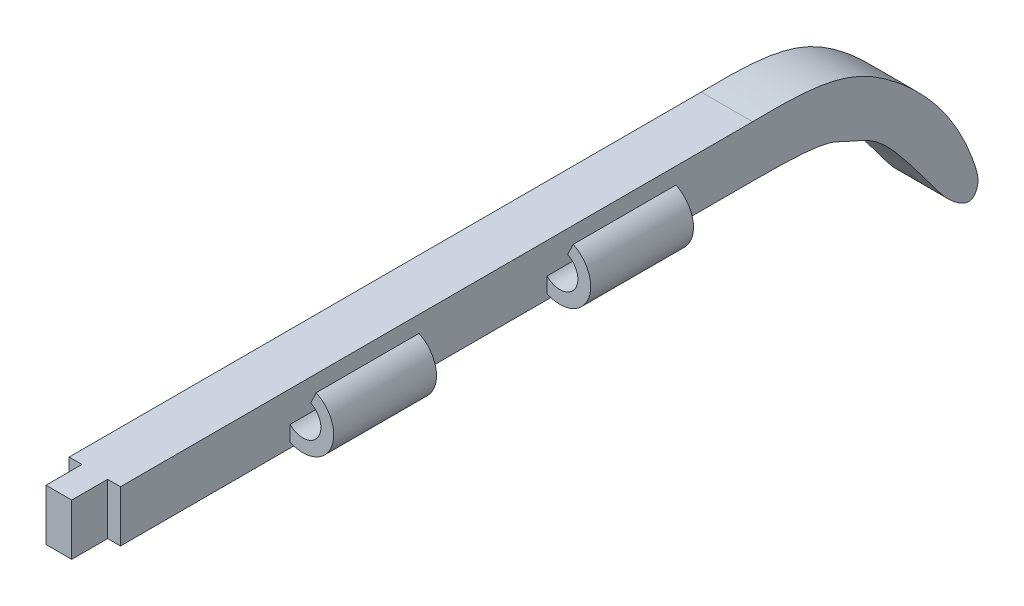
from build123d import *

# Parameters (mm, degrees)
BOSS_EXTRUDE1_DEPTH = 10
BOSS_EXTRUDE2_DEPTH = 10
SKETCH7_W           = 2.5
SKETCH7_H           = 10
CUT_EXTRUDE1_DEPTH  = 7


with BuildPart() as part:
    # Sketch3 → Boss-Extrude1 (new body)
    with BuildSketch(Plane(origin=(0, 0, 0), x_dir=(0, 0, -1), z_dir=(1, 0, 0))):
        with BuildLine():
            Line((0, 10), (130, 10))
            add(Edge.make_bspline(
                [(130, 10), (143.257831062, 10.295968591), (152.362580677, 8.411339369), (167.478605766, -5.773344354), (172.615930834, -16.282094646), (174.074786887, -21.87323482), (172.857902226, -25.275077888), (168.561594529, -23.155195651), (157.061538089, -7.448521863), (154.600537824, -5.126556057), (145.232328073, -1.239475242), (144.477420142, 0), (130, 0)],
                knots=[0, 0, 0, 0, 0.101519052, 0.157910707, 0.21054164, 0.223356202, 0.228060175, 0.254301241, 0.299209562, 0.632235058, 0.706476921, 1, 1, 1, 1], degree=3))
            Line((130, 0), (0, 0))
            Line((0, 0), (0, 10))
        make_face()
    extrude(amount=BOSS_EXTRUDE1_DEPTH)

    # Sketch6 → Boss-Extrude2 (add, symmetric)
    with BuildSketch(Plane.XY.offset(-50)):
        with BuildLine():
            ThreePointArc((10, 1), (17.927654306, 3.919416468), (15.07763977, 11.872284658))
            Line((15.07763977, 11.872284658), (14, 9.616471606))
            ThreePointArc((14, 9.616471606), (15.342193352, 4.427956093), (10, 4))
            Line((10, 4), (10, 1))
        make_face()
    boss_extrude2 = extrude(amount=BOSS_EXTRUDE2_DEPTH, both=True)

    # Mirror4: Boss-Extrude2 across plane
    add(boss_extrude2.mirror(Plane.XY.offset(-75)))

    # Sketch7 → Cut-Extrude1 (cut)
    with BuildSketch(Plane.XY):
        with Locations((1.25, 5)):
            Rectangle(SKETCH7_W, SKETCH7_H)
        with Locations((8.75, 5)):
            Rectangle(SKETCH7_W, SKETCH7_H)
    extrude(amount=-CUT_EXTRUDE1_DEPTH, mode=Mode.SUBTRACT)


solid = part.part
